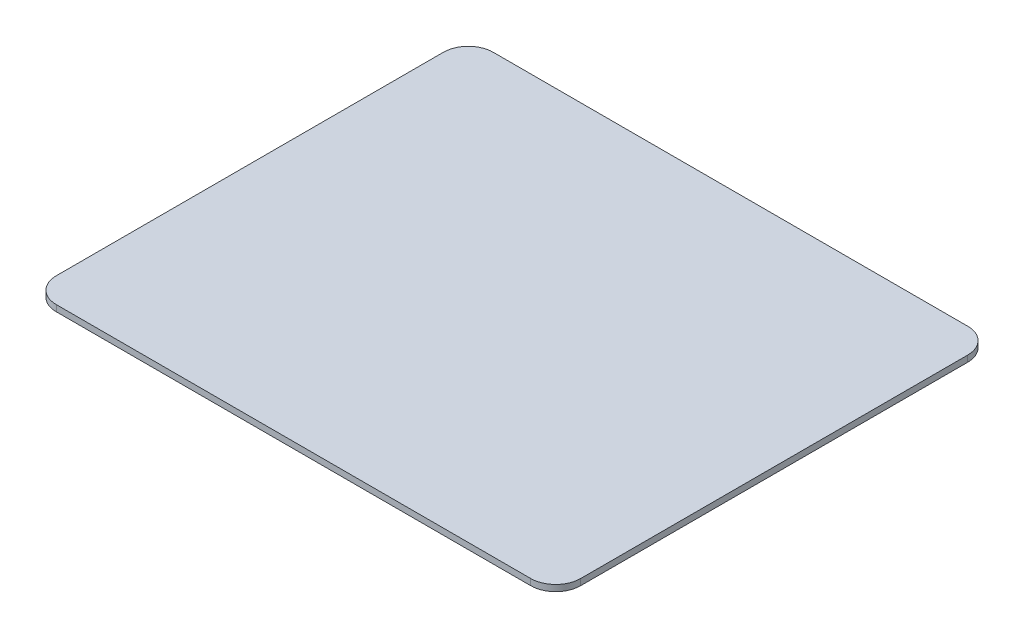
from build123d import *

# Parameters (mm, degrees)
SKETCH_1_W      = 420
SKETCH_1_H      = 350
EXTRUDE_1_DEPTH = 5
FILLET_1_R      = 20


with BuildPart() as part:
    # 草图1 → 凸台-拉伸1 (new body)
    with BuildSketch(Plane(origin=(0, 0, 0), x_dir=(1, 0, 0), z_dir=(0, 1, 0))):
        Rectangle(SKETCH_1_W, SKETCH_1_H)
    extrude(amount=EXTRUDE_1_DEPTH)

    # 圆角1
    fillet_1_edges = [part.edges().sort_by_distance(p)[0] for p in [
        (210, 2.5, 175),
        (-210, 2.5, 175),
        (-210, 2.5, -175),
        (210, 2.5, -175),
    ]]
    fillet(fillet_1_edges, radius=FILLET_1_R)


solid = part.part
